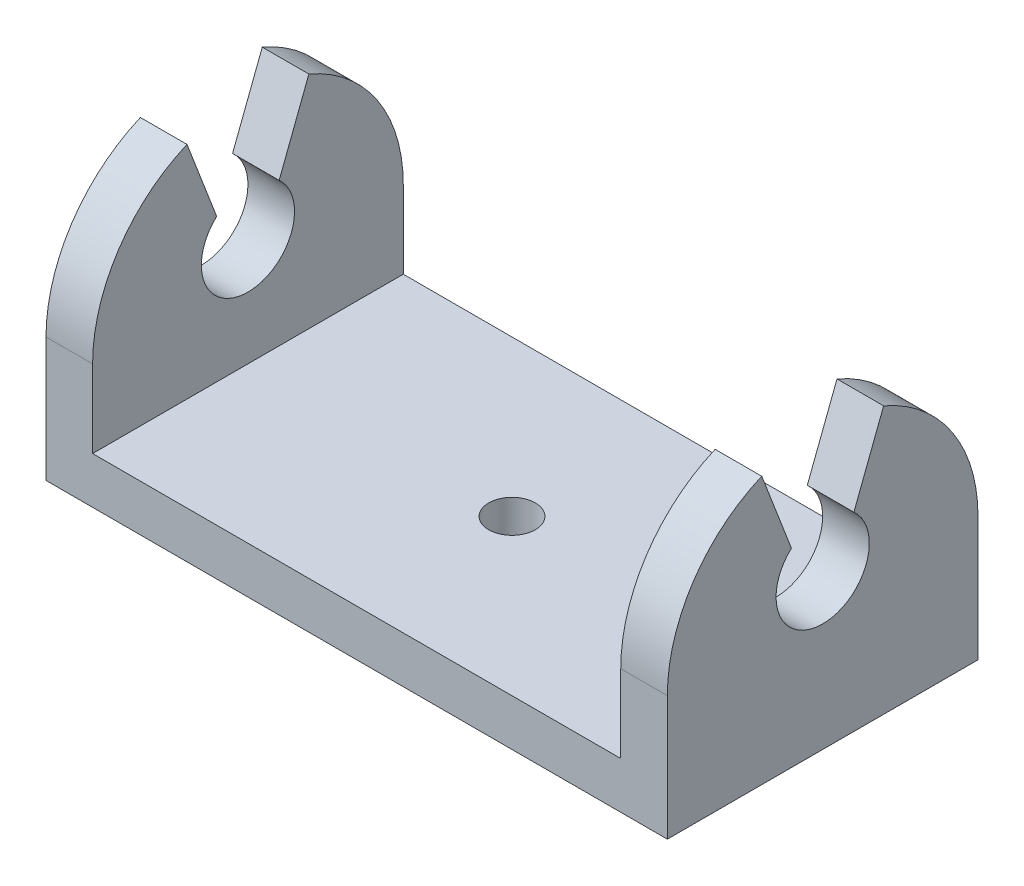
from build123d import *

# Parameters (mm, degrees)
SKETCH1_W                   = 40
SKETCH1_H                   = 20
BOSS_EXTRUDE1_DEPTH         = 3
SKETCH2_W                   = 3
SKETCH2_H                   = 20
BOSS_EXTRUDE2_DEPTH         = 15
CUT_EXTRUDE1_REACH          = 46.989
SKETCH4_R                   = 3
FILLET1_RADIUS              = 10
FILLET1_LENGTH              = 3
CUT_EXTRUDE3_REACH          = 46.989
FILLET1_OF_MIRROR1_2_RADIUS = 10
FILLET1_OF_MIRROR1_2_LENGTH = 3
CUT_EXTRUDE2_REACH          = 30.21
SKETCH6_R                   = 1.5


with BuildPart() as part:
    # Sketch1 → Boss-Extrude1 (new body)
    with BuildSketch(Plane(origin=(0, 0, 0), x_dir=(1, 0, 0), z_dir=(0, 1, 0))):
        Rectangle(SKETCH1_W, SKETCH1_H)
    extrude(amount=BOSS_EXTRUDE1_DEPTH)

    # Sketch2 → Boss-Extrude2 (add)
    with BuildSketch(Plane(origin=(0, 3, 0), x_dir=(1, 0, 0), z_dir=(0, 1, 0))):
        with Locations((-18.5, 0)):
            Rectangle(SKETCH2_W, SKETCH2_H)
    boss_extrude2 = extrude(amount=BOSS_EXTRUDE2_DEPTH)

    # Sketch4 → Cut-Extrude1 (cut, up to next)
    with BuildSketch(Plane.ZY.offset(20), mode=Mode.PRIVATE) as cut_extrude1_sk1:
        with Locations((0, 10)):
            Circle(SKETCH4_R)
    cut_extrude1_tool1 = extrude(cut_extrude1_sk1.sketch, amount=-CUT_EXTRUDE1_REACH, mode=Mode.PRIVATE) & part.part
    cut_extrude1 = cut_extrude1_tool1.solids().sort_by_distance((-20, 10, 0))[0]
    add(cut_extrude1, mode=Mode.SUBTRACT)

    # Fillet1: full round fillet: the end face becomes a half cylinder, R = half its width
    fillet1_face = Plane((-18.5, 18, 0), x_dir=(1, 0, 0), z_dir=(0, 1, 0))  # on the end face: x along it, z out of the body
    fillet1_slab = fillet1_face.offset(-FILLET1_RADIUS / 2) * Box(FILLET1_LENGTH, 2 * FILLET1_RADIUS, FILLET1_RADIUS, mode=Mode.PRIVATE)  # the body's end, R deep
    fillet1_round = Plane((-18.5, 8, 0), x_dir=(0, 1, 0), z_dir=(1, 0, 0)) * Cylinder(FILLET1_RADIUS, FILLET1_LENGTH, mode=Mode.PRIVATE)  # its axis R under the face
    add(fillet1_slab - fillet1_round, mode=Mode.SUBTRACT)

    # Sketch8 → Cut-Extrude3 (cut, up to next)
    with BuildSketch(Plane.ZY.offset(20), mode=Mode.PRIVATE) as cut_extrude3_sk1:
        Polygon((0, 7), (5, 20), (-5, 20), align=None)
    cut_extrude3_tool1 = extrude(cut_extrude3_sk1.sketch, amount=-CUT_EXTRUDE3_REACH, mode=Mode.PRIVATE) & part.part
    cut_extrude3 = cut_extrude3_tool1.solids().sort_by_distance((-20, 15.666667, 0))[0]
    add(cut_extrude3, mode=Mode.SUBTRACT)

    # Mirror1: Boss-Extrude2, Cut-Extrude1, Cut-Extrude3 across plane
    add(boss_extrude2.mirror(Plane(origin=(0, 0, 0), x_dir=(0, 0, 1), z_dir=(1, 0, 0))))
    add(cut_extrude1.mirror(Plane(origin=(0, 0, 0), x_dir=(0, 0, 1), z_dir=(1, 0, 0))), mode=Mode.SUBTRACT)
    add(cut_extrude3.mirror(Plane(origin=(0, 0, 0), x_dir=(0, 0, 1), z_dir=(1, 0, 0))), mode=Mode.SUBTRACT)

    # Fillet1 of Mirror1 2: full round fillet: the end face becomes a half cylinder, R = half its width
    fillet1_of_mirror1_2_face = Plane((18.5, 18, 0), x_dir=(-1, 0, 0), z_dir=(0, 1, 0))  # on the end face: x along it, z out of the body
    fillet1_of_mirror1_2_slab = fillet1_of_mirror1_2_face.offset(-FILLET1_OF_MIRROR1_2_RADIUS / 2) * Box(FILLET1_OF_MIRROR1_2_LENGTH, 2 * FILLET1_OF_MIRROR1_2_RADIUS, FILLET1_OF_MIRROR1_2_RADIUS, mode=Mode.PRIVATE)  # the body's end, R deep
    fillet1_of_mirror1_2_round = Plane((18.5, 8, 0), x_dir=(0, 1, 0), z_dir=(-1, 0, 0)) * Cylinder(FILLET1_OF_MIRROR1_2_RADIUS, FILLET1_OF_MIRROR1_2_LENGTH, mode=Mode.PRIVATE)  # its axis R under the face
    add(fillet1_of_mirror1_2_slab - fillet1_of_mirror1_2_round, mode=Mode.SUBTRACT)

    # Sketch6 → Cut-Extrude2 (cut, up to next)
    with BuildSketch(Plane.XZ, mode=Mode.PRIVATE) as cut_extrude2_sk1:
        with Locations(Location((0, 0, 0), (0, 0, 270))):
            Circle(SKETCH6_R)
    cut_extrude2_tool1 = extrude(cut_extrude2_sk1.sketch, amount=-CUT_EXTRUDE2_REACH, mode=Mode.PRIVATE) & part.part
    add(cut_extrude2_tool1.solids().sort_by_distance((0, 0, 0))[0], mode=Mode.SUBTRACT)


solid = part.part
